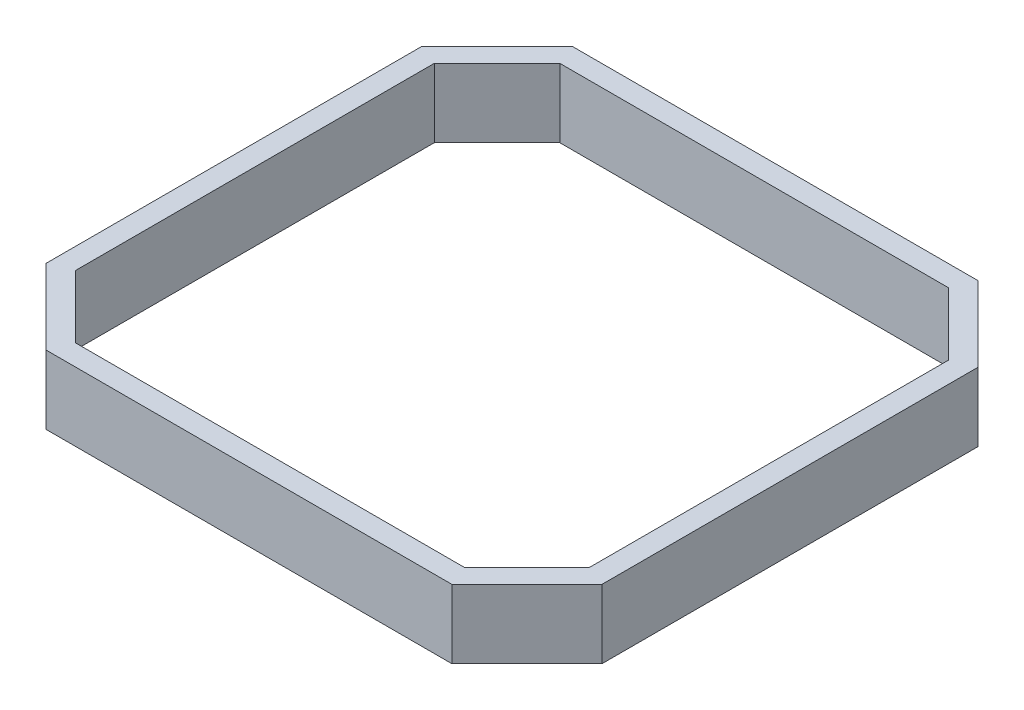
from build123d import *

# Parameters (mm, degrees)
BOSS_EXTRUDE1_DEPTH = 11.5


with BuildPart() as part:
    # Sketch1 → Boss-Extrude1 (new body)
    with BuildSketch(Plane(origin=(0, 0, 0), x_dir=(1, 0, 0), z_dir=(0, 1, 0))):
        Polygon((-46.5, 31.449747468), (-33.949747468, 44), (33.949747468, 44), (46.5, 31.449747468), (46.5, -31.449747468), (33.949747468, -44), (-33.949747468, -44), (-46.5, -31.449747468), align=None)
        Polygon((-43, 30), (-32.5, 40.5), (32.5, 40.5), (43, 30), (43, -30), (32.5, -40.5), (-32.5, -40.5), (-43, -30), align=None, mode=Mode.SUBTRACT)
    extrude(amount=BOSS_EXTRUDE1_DEPTH)


solid = part.part
